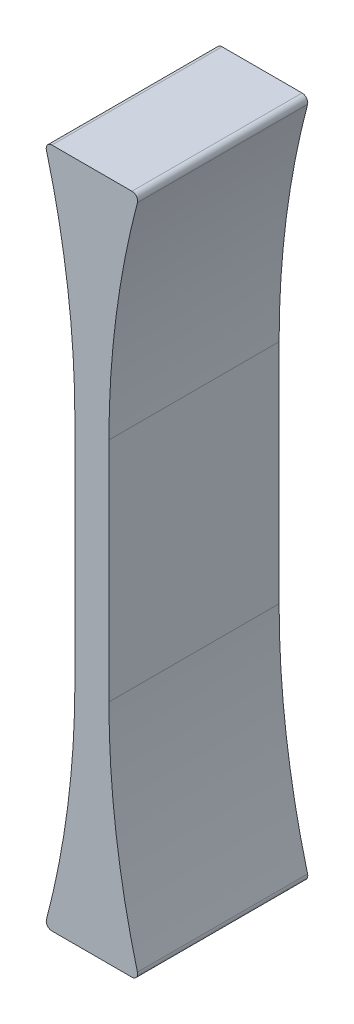
from build123d import *

# Parameters (mm, degrees)
BOSS_EXTRUDE1_DEPTH = 15
FILLET1_R           = 0.5


with BuildPart() as part:
    # Sketch1 → Boss-Extrude1 (new body)
    with BuildSketch(Plane.XY):
        with BuildLine():
            Line((0, 0), (1.5, 0))
            Line((1.5, 0), (1.5, 10))
            ThreePointArc((1.5, 10), (2.172674131, 20.089300148), (4.178788881, 30))
            Line((4.178788881, 30), (0, 30))
            Line((0, 30), (0, 0))
        make_face()
    boss_extrude1 = extrude(amount=BOSS_EXTRUDE1_DEPTH)

    # Mirror1: Boss-Extrude1 across plane
    add(boss_extrude1.mirror(Plane(origin=(0, 30, 15), x_dir=(0, 0, 1), z_dir=(1, 0, 0))))

    # Mirror6: part across plane


with BuildPart() as part_1:
    add(part.part)
    add(part.part.mirror(Plane(origin=(0, 0, 15), x_dir=(0, 0, 1), z_dir=(0, 1, 0))))

    # Fillet1
    fillet1_edges = [part_1.edges().sort_by_distance(p)[0] for p in [
        (-4.178788881, 30, 7.5),
        (4.178788881, -30, 7.5),
        (-4.178788881, -30, 7.5),
        (4.178788881, 30, 7.5),
    ]]
    fillet(fillet1_edges, radius=FILLET1_R)


solid = part_1.part
